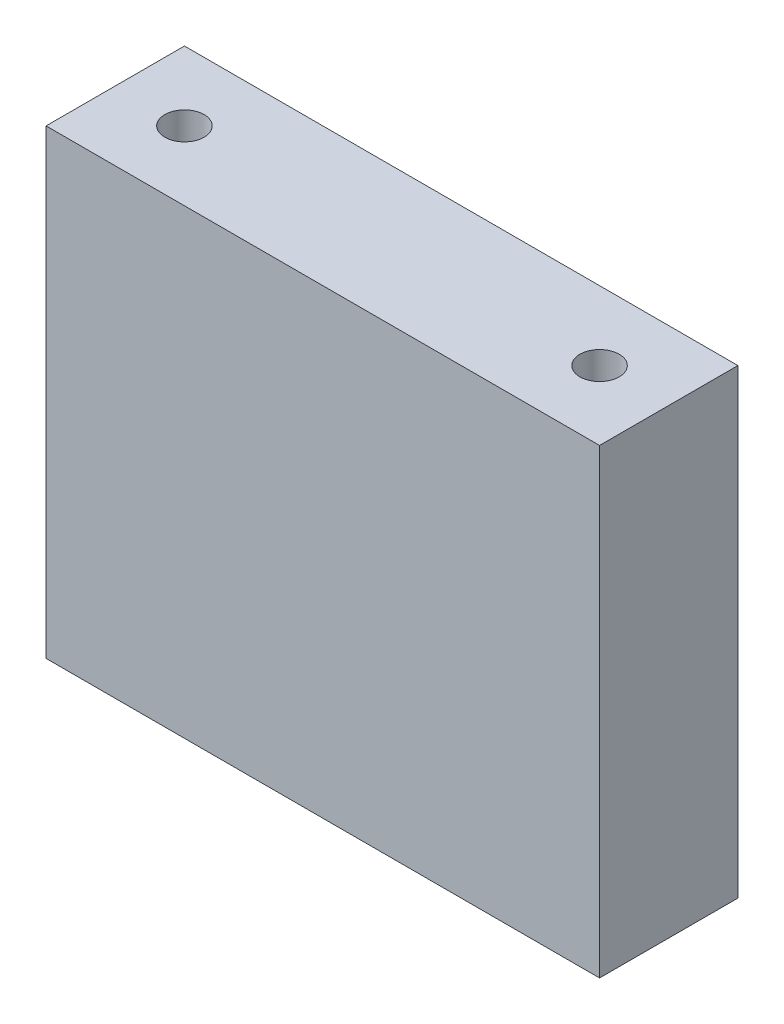
from build123d import *

# Parameters (mm, degrees)
SKETCH1_W                 = 38.1
SKETCH1_H                 = 31.75
BOSS_EXTRUDE1_DEPTH       = 9.525
F_6_32_TAPPED_HOLE1_D     = 2.7051
F_6_32_TAPPED_HOLE1_DEPTH = 7.62
F_6_32_TAPPED_HOLE1_TIP   = 0.81269403
F_6_32_TAPPED_HOLE2_D     = 2.7051
F_6_32_TAPPED_HOLE2_DEPTH = 9.38784
F_6_32_TAPPED_HOLE2_TIP   = 0.81269403


with BuildPart() as part:
    # Sketch1 → Boss-Extrude1 (new body)
    with BuildSketch(Plane.XY):
        Rectangle(SKETCH1_W, SKETCH1_H)
    extrude(amount=BOSS_EXTRUDE1_DEPTH)

    # #6-32 Tapped Hole1
    with Locations(Plane(origin=(0, 15.875, 0), x_dir=(1, 0, 0), z_dir=(0, 1, 0))):
        with Locations((-14.2875, -4.7625), (14.2875, -4.7625)):
            Hole(F_6_32_TAPPED_HOLE1_D / 2, depth=F_6_32_TAPPED_HOLE1_DEPTH)
            with Locations((0, 0, -(F_6_32_TAPPED_HOLE1_DEPTH + F_6_32_TAPPED_HOLE1_TIP / 2))):  # 118° drill point
                Cone(0, F_6_32_TAPPED_HOLE1_D / 2, F_6_32_TAPPED_HOLE1_TIP, mode=Mode.SUBTRACT)

    # #6-32 Tapped Hole2
    with Locations(Plane(origin=(0, -15.875, 0), x_dir=(-1, 0, 0), z_dir=(0, -1, 0))):
        with Locations((-14.2875, -4.7625), (14.2875, -4.7625)):
            Hole(F_6_32_TAPPED_HOLE2_D / 2, depth=F_6_32_TAPPED_HOLE2_DEPTH)
            with Locations((0, 0, -(F_6_32_TAPPED_HOLE2_DEPTH + F_6_32_TAPPED_HOLE2_TIP / 2))):  # 118° drill point
                Cone(0, F_6_32_TAPPED_HOLE2_D / 2, F_6_32_TAPPED_HOLE2_TIP, mode=Mode.SUBTRACT)


solid = part.part
